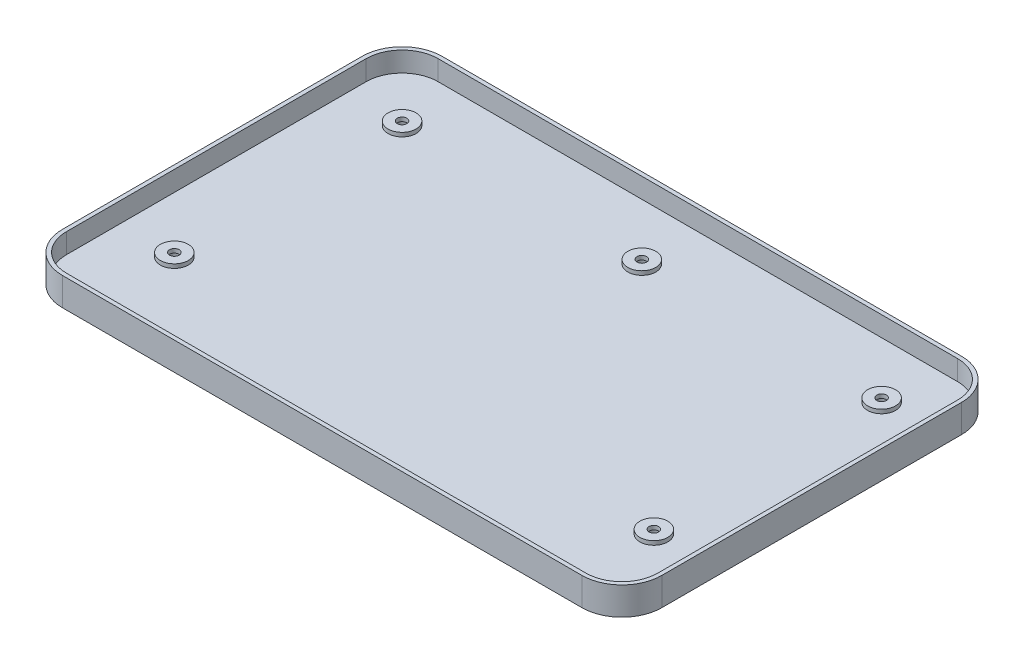
from build123d import *

# Parameters (mm, degrees)
EXTRUDE_1_DEPTH      = 3
EXTRUDE_2_DEPTH      = 5
SKETCH_4_R           = 1.85
CUT_EXTRUDE_1_DEPTH  = 2
SKETCH_5_R           = 1.1
CUT_EXTRUDE_2_DEPTH  = 2
CUT_EXTRUDE_START    = -1
SKETCH_6_R           = 3.5
CUT_EXTRUDE_3_DEPTH  = 1
SKETCH_7_R           = 1.1
CUT_EXTRUDE_4_DEPTH  = 2
SKETCH_8_R           = 1.85
CUT_EXTRUDE_6_DEPTH  = 2
SKETCH_9_R           = 4
CUT_EXTRUDE_7_DEPTH  = 1
SKETCH_11_R          = 1.2
CUT_EXTRUDE_8_DEPTH  = 10
SKETCH_12_R          = 6.320671045
CUT_EXTRUDE_9_DEPTH  = 10
EXTRUDE_START        = -2
SKETCH_13_R          = 1.85
EXTRUDE_3_DEPTH      = 2
CUT_EXTRUDE_10_DEPTH = 1


with BuildPart() as part:
    # 스케치1 → 보스-돌출1 (new body)
    with BuildSketch(Plane(origin=(0, 0, 0), x_dir=(1, 0, 0), z_dir=(0, 1, 0))):
        with BuildLine():
            Line((-65, 47.5), (65, 47.5))
            ThreePointArc((65, 47.5), (72.071067812, 44.571067812), (75, 37.5))
            Line((75, 37.5), (75, -37.5))
            ThreePointArc((75, -37.5), (72.071067812, -44.571067812), (65, -47.5))
            Line((65, -47.5), (-65, -47.5))
            ThreePointArc((-65, -47.5), (-72.071067812, -44.571067812), (-75, -37.5))
            Line((-75, -37.5), (-75, 37.5))
            ThreePointArc((-75, 37.5), (-72.071067812, 44.571067812), (-65, 47.5))
        make_face()
    extrude(amount=EXTRUDE_1_DEPTH)

    # 스케치2 → 보스-돌출2 (add)
    with BuildSketch(Plane(origin=(0, 3, 0), x_dir=(1, 0, 0), z_dir=(0, 1, 0))):
        with BuildLine():
            Line((-75, 37.5), (-75, -37.5))
            ThreePointArc((-75, -37.5), (-72.071067812, -44.571067812), (-65, -47.5))
            Line((-65, -47.5), (65, -47.5))
            ThreePointArc((65, -47.5), (72.071067812, -44.571067812), (75, -37.5))
            Line((75, -37.5), (75, 37.5))
            ThreePointArc((75, 37.5), (72.071067812, 44.571067812), (65, 47.5))
            Line((65, 47.5), (-65, 47.5))
            ThreePointArc((-65, 47.5), (-72.071067812, 44.571067812), (-75, 37.5))
        make_face()
        with BuildLine():
            Line((-74, 37.5), (-74, -37.5))
            ThreePointArc((-74, -37.5), (-71.363961031, -43.863961031), (-65, -46.5))
            Line((-65, -46.5), (65, -46.5))
            ThreePointArc((65, -46.5), (71.363961031, -43.863961031), (74, -37.5))
            Line((74, -37.5), (74, 37.5))
            ThreePointArc((74, 37.5), (71.363961031, 43.863961031), (65, 46.5))
            Line((65, 46.5), (-65, 46.5))
            ThreePointArc((-65, 46.5), (-71.363961031, 43.863961031), (-74, 37.5))
        make_face(mode=Mode.SUBTRACT)
    extrude(amount=EXTRUDE_2_DEPTH)

    # 스케치4 → 컷-돌출1 (cut)
    with BuildSketch(Plane.XZ):
        with Locations((-60, -32.490092216)):
            Circle(SKETCH_4_R)
        with Locations((60, -32.490092216)):
            Circle(SKETCH_4_R)
        with Locations((-60, 24.501769847)):
            Circle(SKETCH_4_R)
        with Locations((60, 24.501769847)):
            Circle(SKETCH_4_R)
    extrude(amount=-CUT_EXTRUDE_1_DEPTH, mode=Mode.SUBTRACT)

    # 스케치5 → 컷-돌출2 (cut)
    with BuildSketch(Plane.XZ.offset(-2)):
        with Locations((60, -32.490092216)):
            Circle(SKETCH_5_R)
        with Locations((60, 24.501769847)):
            Circle(SKETCH_5_R)
        with Locations((-60, 24.501769847)):
            Circle(SKETCH_5_R)
        with Locations((-60, -32.490092216)):
            Circle(SKETCH_5_R)
    extrude(amount=-CUT_EXTRUDE_2_DEPTH, mode=Mode.SUBTRACT)

    # 스케치6 → 컷-돌출3 (cut)
    with BuildSketch(Plane(origin=(0, 3, 0), x_dir=(1, 0, 0), z_dir=(0, 1, 0)).offset(CUT_EXTRUDE_START)):
        with BuildLine():
            ThreePointArc((-65, 46.5), (-71.363961031, 43.863961031), (-74, 37.5))
            Line((-74, 37.5), (-74, -37.5))
            ThreePointArc((-74, -37.5), (-71.363961031, -43.863961031), (-65, -46.5))
            Line((-65, -46.5), (65, -46.5))
            ThreePointArc((65, -46.5), (71.363961031, -43.863961031), (74, -37.5))
            Line((74, -37.5), (74, 37.5))
            ThreePointArc((74, 37.5), (71.363961031, 43.863961031), (65, 46.5))
            Line((65, 46.5), (-65, 46.5))
        make_face()
        with Locations((-60, -24.501769847)):
            Circle(SKETCH_6_R, mode=Mode.SUBTRACT)
        with Locations((0, -24.501769847)):
            Circle(SKETCH_6_R, mode=Mode.SUBTRACT)
        with Locations((60, -24.501769847)):
            Circle(SKETCH_6_R, mode=Mode.SUBTRACT)
        with Locations((-60, 32.490092216)):
            Circle(SKETCH_6_R, mode=Mode.SUBTRACT)
        with Locations((0, 32.490092216)):
            Circle(SKETCH_6_R, mode=Mode.SUBTRACT)
        with Locations((60, 32.490092216)):
            Circle(SKETCH_6_R, mode=Mode.SUBTRACT)
    extrude(amount=CUT_EXTRUDE_3_DEPTH, mode=Mode.SUBTRACT)

    # 스케치7 → 컷-돌출4 (cut)
    with BuildSketch(Plane(origin=(0, 3, 0), x_dir=(1, 0, 0), z_dir=(0, 1, 0))):
        with Locations((0, -24.501769847)):
            Circle(SKETCH_7_R)
        with Locations((0, 32.490092216)):
            Circle(SKETCH_7_R)
    extrude(amount=-CUT_EXTRUDE_4_DEPTH, mode=Mode.SUBTRACT)

    # 스케치8 → 컷-돌출6 (cut)
    with BuildSketch(Plane.XZ):
        with Locations((-60, 24.501769847)):
            Circle(SKETCH_8_R)
        with Locations((0, 24.501769847)):
            Circle(SKETCH_8_R)
        with Locations((-60, -32.490092216)):
            Circle(SKETCH_8_R)
        with Locations((0, -32.490092216)):
            Circle(SKETCH_8_R)
    extrude(amount=-CUT_EXTRUDE_6_DEPTH, mode=Mode.SUBTRACT)

    # 스케치9 → 컷-돌출7 (cut)
    with BuildSketch(Plane.XZ):
        with Locations((-65, 37.5)):
            Circle(SKETCH_9_R)
        with Locations((65, -37.5)):
            Circle(SKETCH_9_R)
        with Locations((-65, -37.5)):
            Circle(SKETCH_9_R)
        with Locations((65, 37.5)):
            Circle(SKETCH_9_R)
    extrude(amount=-CUT_EXTRUDE_7_DEPTH, mode=Mode.SUBTRACT)

    # 스케치11 → 컷-돌출8 (cut)
    with BuildSketch(Plane(origin=(0, 3, 0), x_dir=(1, 0, 0), z_dir=(0, 1, 0))):
        with Locations((-60, -24.501769847)):
            Circle(SKETCH_11_R)
        with Locations((-60, 32.490092216)):
            Circle(SKETCH_11_R)
        with Locations((0, 32.490092216)):
            Circle(SKETCH_11_R)
        with Locations((60, 32.490092216)):
            Circle(SKETCH_11_R)
        with Locations((60, -24.501769847)):
            Circle(SKETCH_11_R)
    extrude(amount=-CUT_EXTRUDE_8_DEPTH, mode=Mode.SUBTRACT)

    # 스케치12 → 컷-돌출9 (cut)
    with BuildSketch(Plane(origin=(0, 2, 0), x_dir=(1, 0, 0), z_dir=(0, 1, 0))):
        with Locations((0, -24.501769847)):
            Circle(SKETCH_12_R)
    extrude(amount=CUT_EXTRUDE_9_DEPTH, mode=Mode.SUBTRACT)

    # 스케치13 → 보스-돌출3 (add)
    with BuildSketch(Plane(origin=(0, 2, 0), x_dir=(1, 0, 0), z_dir=(0, 1, 0)).offset(EXTRUDE_START)):
        with Locations((0, -24.501769847)):
            Circle(SKETCH_13_R)
    extrude(amount=EXTRUDE_3_DEPTH)

    # 스케치15 → 컷-돌출10 (cut)
    with BuildSketch(Plane(origin=(0, 8, 0), x_dir=(1, 0, 0), z_dir=(0, 1, 0)).offset(CUT_EXTRUDE_START)):
        with BuildLine():
            Line((-75, 37.5), (-75, -37.5))
            ThreePointArc((-75, -37.5), (-72.071067812, -44.571067812), (-65, -47.5))
            Line((-65, -47.5), (65, -47.5))
            ThreePointArc((65, -47.5), (72.071067812, -44.571067812), (75, -37.5))
            Line((75, -37.5), (75, 37.5))
            ThreePointArc((75, 37.5), (72.071067812, 44.571067812), (65, 47.5))
            Line((65, 47.5), (-65, 47.5))
            ThreePointArc((-65, 47.5), (-72.071067812, 44.571067812), (-75, 37.5))
        make_face()
    extrude(amount=CUT_EXTRUDE_10_DEPTH, mode=Mode.SUBTRACT)


solid = part.part
